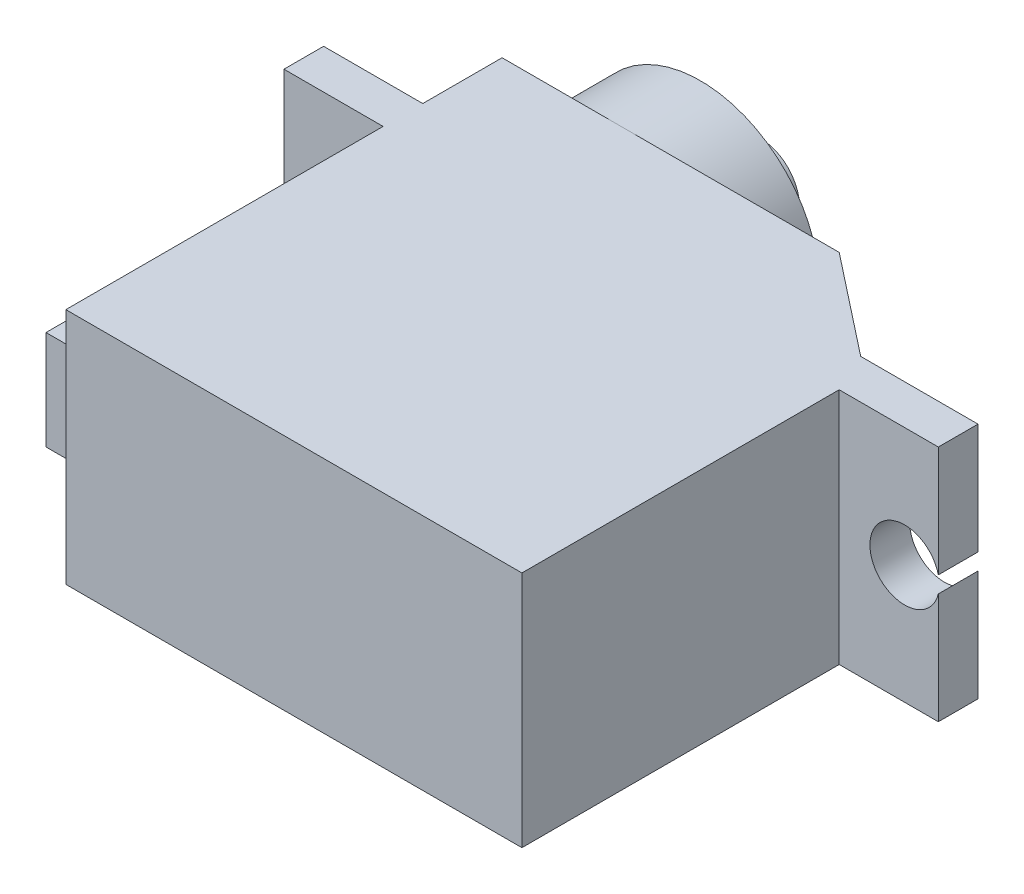
from build123d import *

# Parameters (mm, degrees)
BOSS_EXTRU_1_DEPTH      = 12
BOSS_EXTRU_2_DEPTH      = 5
BOSS_EXTRU_2_DEPTH_BACK = 28
ESQUISSE2_W             = 2
ESQUISSE2_H             = 12
ESQUISSE3_R             = 1.75
ENL_V_MAT_EXTRU_2_DEPTH = 5
ESQUISSE4_R             = 1.75
ENL_V_MAT_EXTRU_3_DEPTH = 5
ESQUISSE5_R             = 6
BOSS_EXTRU_3_DEPTH      = 4
ESQUISSE6_R             = 2
BOSS_EXTRU_4_DEPTH      = 3
ESQUISSE7_W             = 2
ESQUISSE7_H             = 5
BOSS_EXTRU_5_DEPTH      = 3


with BuildPart() as part:
    # Esquisse1 → Boss.-Extru.1 (new body)
    with BuildSketch(Plane(origin=(0, 0, 0), x_dir=(1, 0, 0), z_dir=(0, 1, 0))):
        Polygon((17, 22), (23, 17.279676248), (23, 0), (0, 0), (0, 22), align=None)
    extrude(amount=BOSS_EXTRU_1_DEPTH)

    # Esquisse2 → Boss.-Extru.2 (add, two sides: drawn at the far end of the back side and taken through both)
    with BuildSketch(Plane.ZY.offset(-BOSS_EXTRU_2_DEPTH_BACK)):
        with Locations((-17, 6)):
            Rectangle(ESQUISSE2_W, ESQUISSE2_H)
    extrude(amount=BOSS_EXTRU_2_DEPTH + BOSS_EXTRU_2_DEPTH_BACK)

    # Esquisse3 → Enlèv. mat.-Extru.2 (cut)
    with BuildSketch(Plane(origin=(0, 0, -18), x_dir=(-1, 0, 0), z_dir=(0, 0, -1))):
        with Locations((3.3, 6)):
            Circle(ESQUISSE3_R)
    extrude(amount=-ENL_V_MAT_EXTRU_2_DEPTH, mode=Mode.SUBTRACT)

    # Esquisse4 → Enlèv. mat.-Extru.3 (cut)
    with BuildSketch(Plane(origin=(0, 0, -18), x_dir=(-1, 0, 0), z_dir=(0, 0, -1))):
        with Locations((-26.3, 6)):
            Circle(ESQUISSE4_R)
    extrude(amount=-ENL_V_MAT_EXTRU_3_DEPTH, mode=Mode.SUBTRACT)

    # Esquisse5 → Boss.-Extru.3 (add)
    with BuildSketch(Plane(origin=(0, 0, -22), x_dir=(-1, 0, 0), z_dir=(0, 0, -1))):
        with Locations((-6, 6)):
            Circle(ESQUISSE5_R)
    extrude(amount=BOSS_EXTRU_3_DEPTH)

    # Esquisse6 → Boss.-Extru.4 (add)
    with BuildSketch(Plane(origin=(0, 0, -26), x_dir=(-1, 0, 0), z_dir=(0, 0, -1))):
        with Locations((-6, 6)):
            Circle(ESQUISSE6_R)
    extrude(amount=BOSS_EXTRU_4_DEPTH)

    # Esquisse7 → Boss.-Extru.5 (add)
    with BuildSketch(Plane.ZY):
        with Locations((-3, 6)):
            Rectangle(ESQUISSE7_W, ESQUISSE7_H)
    extrude(amount=BOSS_EXTRU_5_DEPTH)


solid = part.part
